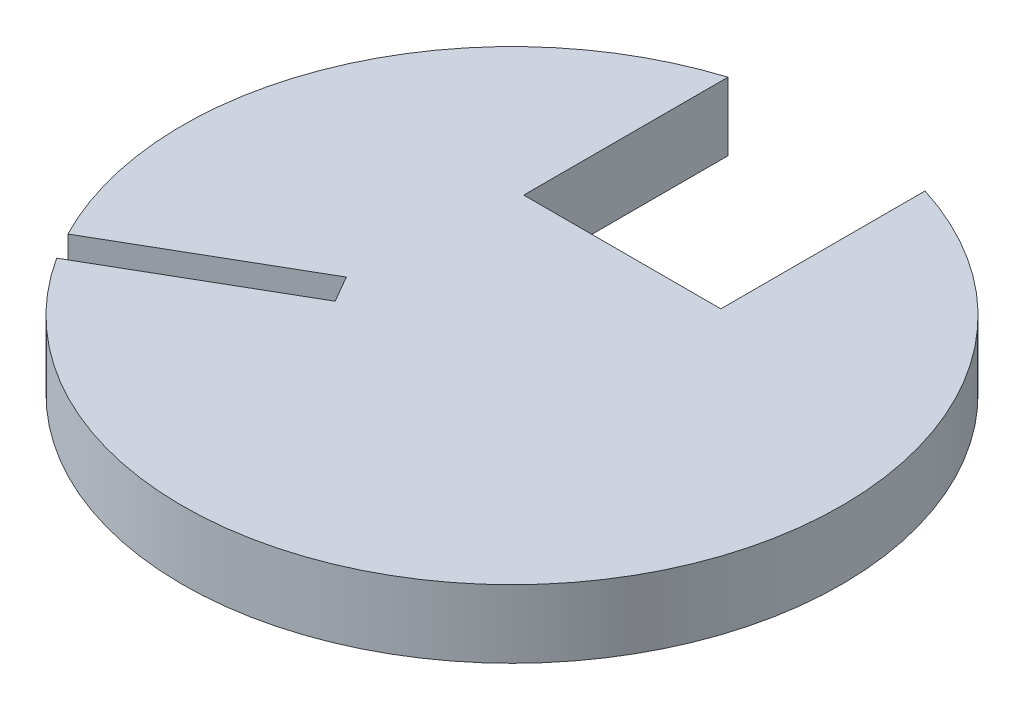
from build123d import *

# Parameters (mm, degrees)
EXTRUDE_1_DEPTH     = 1
CUT_EXTRUDE_1_DEPTH = 1


with BuildPart() as part:
    # 스케치1 → 보스-돌출1 (new body)
    with BuildSketch(Plane(origin=(0, 0, 0), x_dir=(1, 0, 0), z_dir=(0, 1, 0))):
        with BuildLine():
            Line((-1.4475, -1.73), (1.4475, -1.73))
            Line((1.4475, -1.73), (1.4475, 1.27))
            ThreePointArc((1.4475, 1.27), (0, -8.192062176), (-1.4475, 1.27))
            Line((-1.4475, 1.27), (-1.4475, -1.73))
        make_face()
    extrude(amount=EXTRUDE_1_DEPTH)

    # 스케치2 → 컷-돌출1 (cut)
    with BuildSketch(Plane(origin=(0, 1, 0), x_dir=(1, 0, 0), z_dir=(0, 1, 0))):
        Polygon((-4.080578398, -5.96604295), (-4.305578398, -5.576331518), (-1.707502186, -4.076331518), (-1.482502186, -4.46604295), align=None)
    extrude(amount=-CUT_EXTRUDE_1_DEPTH, mode=Mode.SUBTRACT)


solid = part.part
